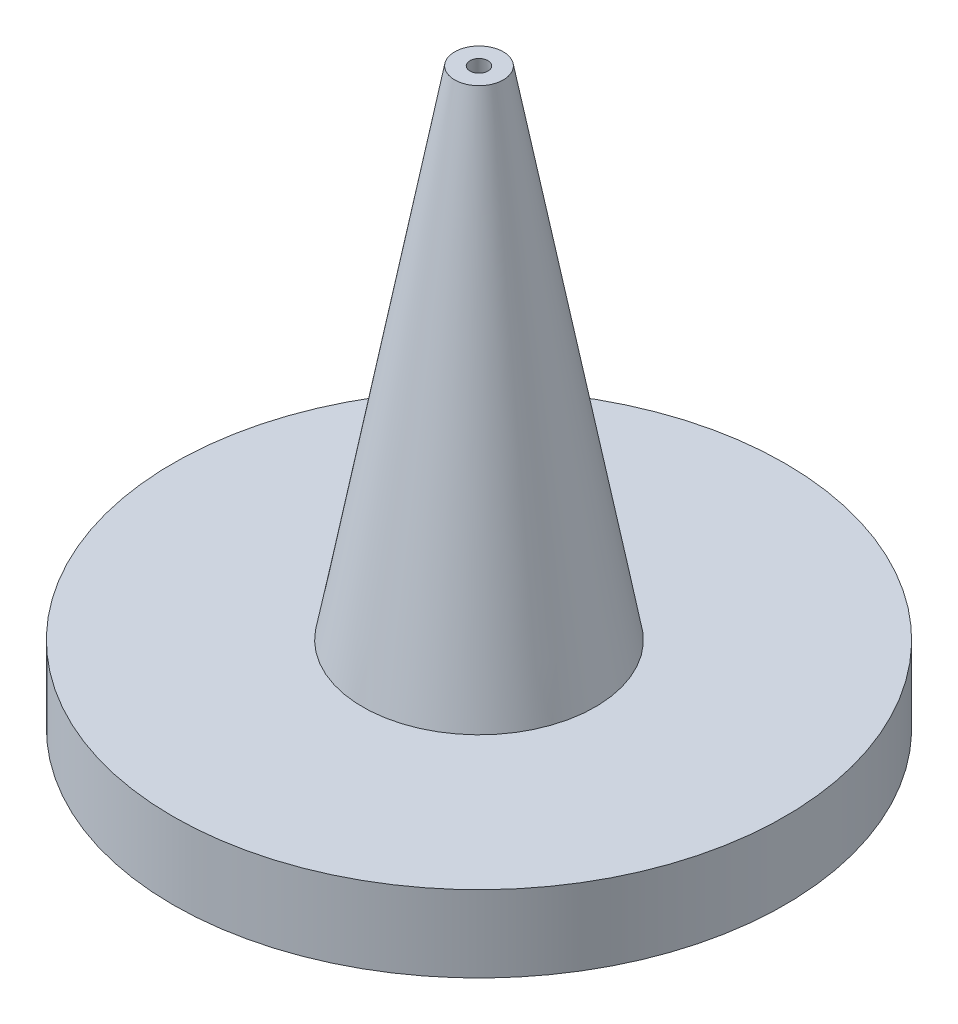
from build123d import *


with BuildPart() as part:
    # Sketch1 → Revolve1 (revolve)
    with BuildSketch(Plane.XY, mode=Mode.PRIVATE) as revolve1_sk:
        Polygon((10.16, 0), (10.16, 2.54), (3.8608, 2.54), (0.80772, 19.05), (0.29972, 19.05), (3.3528, 0), align=None)
    revolve(revolve1_sk.sketch.rotate(Axis((0, 0, 0), (0, 1, 0)), 90), axis=Axis((0, 0, 0), (0, 1, 0)))


solid = part.part
